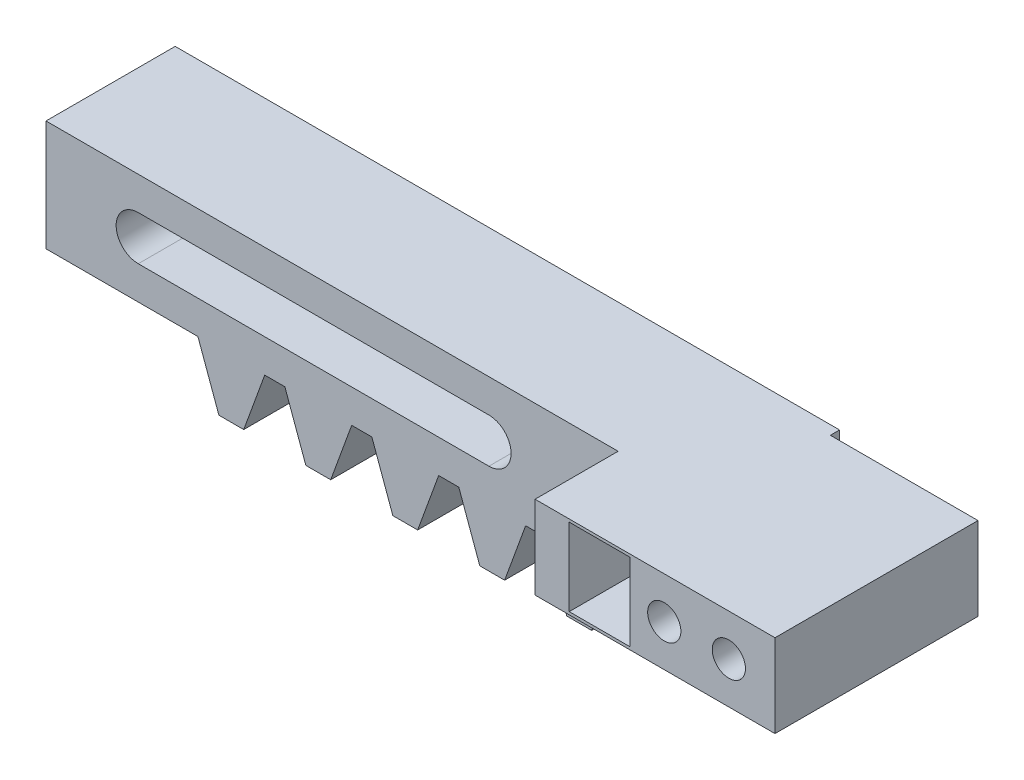
from build123d import *

# Parameters (mm, degrees)
BOSS_EXTRUDE1_START     = 13.5
BOSS_EXTRUDE1_DEPTH     = 7
BOSS_EXTRUDE2_START     = 14
SKETCH2_W               = 13
SKETCH2_H               = 4.5
BOSS_EXTRUDE2_DEPTH     = 11
CUT_EXTRUDE1_START      = 21.7
SKETCH3_W               = 3.3
SKETCH3_H               = 4.2
CUT_EXTRUDE1_DEPTH      = 3.4
CUT_EXTRUDE2_START      = 16
SKETCH4_R               = 0.9
CUT_EXTRUDE2_DEPTH      = 9.1
CUT_EXTRUDE3_DEPTH      = 40.40812892
CUT_EXTRUDE3_DEPTH_BACK = 40.40812892
SKETCH5_W               = 19
SKETCH5_H               = 2.4
CUT_EXTRUDE4_DEPTH      = 40.40812892
CUT_EXTRUDE4_DEPTH_BACK = 40.40812892
SKETCH6_R               = 1.2


with BuildPart() as part:
    # Sketch1 → Boss-Extrude1 (new body)
    with BuildSketch(Plane.XY.offset(BOSS_EXTRUDE1_START)):
        Polygon((-23, 19.975), (13, 19.975), (13, 13.975), (7.70102766, 13.975), (6.563620678, 10.85), (5.217351773, 10.85), (4.079944791, 13.975), (2.988638679, 13.975), (1.851231697, 10.85), (0.504962793, 10.85), (-0.632444189, 13.975), (-1.723750301, 13.975), (-2.861157283, 10.85), (-4.207426188, 10.85), (-5.34483317, 13.975), (-6.436139281, 13.975), (-7.573546263, 10.85), (-8.919815168, 10.85), (-10.05722215, 13.975), (-11.148528262, 13.975), (-12.285935244, 10.85), (-13.632204148, 10.85), (-14.76961113, 13.975), (-23, 13.975), align=None)
    extrude(amount=BOSS_EXTRUDE1_DEPTH)

    # Sketch2 → Boss-Extrude2 (add)
    with BuildSketch(Plane.XY.offset(BOSS_EXTRUDE2_START)):
        with Locations((14.5, 17.725)):
            Rectangle(SKETCH2_W, SKETCH2_H)
    extrude(amount=BOSS_EXTRUDE2_DEPTH)

    # Sketch3 → Cut-Extrude1 (cut)
    with BuildSketch(Plane.XY.offset(CUT_EXTRUDE1_START)):
        with Locations((11.5, 17.725)):
            Rectangle(SKETCH3_W, SKETCH3_H)
    extrude(amount=CUT_EXTRUDE1_DEPTH, mode=Mode.SUBTRACT)

    # Sketch4 → Cut-Extrude2 (cut)
    with BuildSketch(Plane.XY.offset(CUT_EXTRUDE2_START)):
        with Locations((15, 17.725)):
            Circle(SKETCH4_R)
        with Locations((18.5, 17.725)):
            Circle(SKETCH4_R)
    extrude(amount=CUT_EXTRUDE2_DEPTH, mode=Mode.SUBTRACT)

    # Sketch5 → Cut-Extrude3 (cut, two sides: drawn at the far end of the back side and taken through both)
    with BuildSketch(Plane.XY.offset(-CUT_EXTRUDE3_DEPTH_BACK)):
        with Locations((-8.5, 16.975)):
            Rectangle(SKETCH5_W, SKETCH5_H)
    extrude(amount=CUT_EXTRUDE3_DEPTH + CUT_EXTRUDE3_DEPTH_BACK, mode=Mode.SUBTRACT)

    # Sketch6 → Cut-Extrude4 (cut, two sides: drawn at the far end of the back side and taken through both)
    with BuildSketch(Plane.XY.offset(-CUT_EXTRUDE4_DEPTH_BACK)):
        with Locations((-18, 16.975)):
            Circle(SKETCH6_R)
        with Locations((1, 16.975)):
            Circle(SKETCH6_R)
    extrude(amount=CUT_EXTRUDE4_DEPTH + CUT_EXTRUDE4_DEPTH_BACK, mode=Mode.SUBTRACT)


solid = part.part
